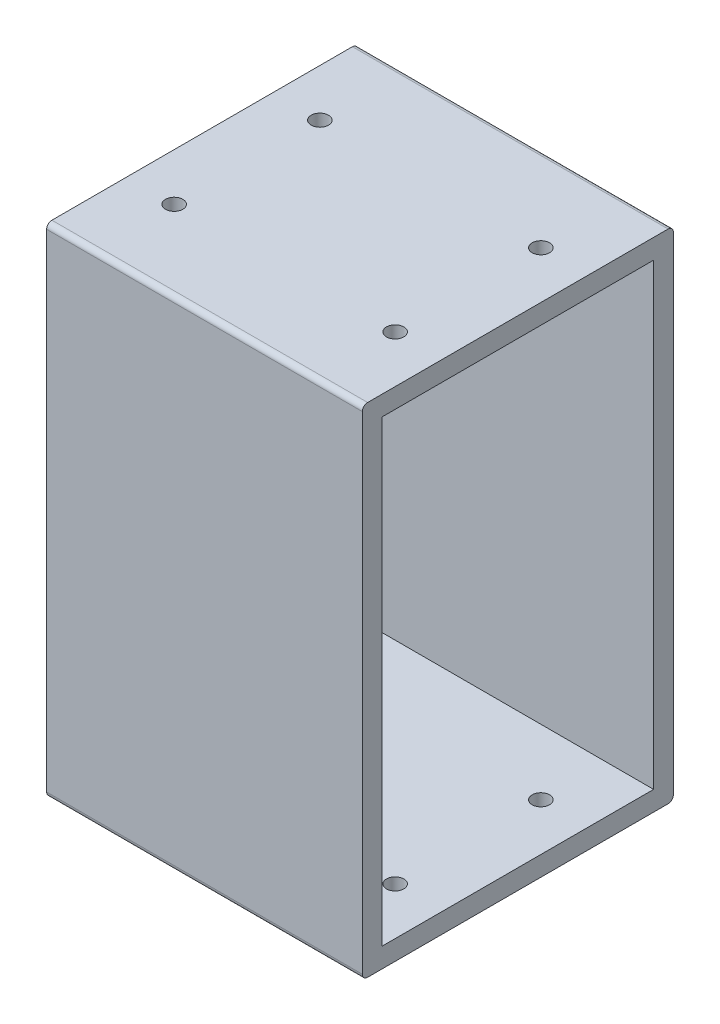
from build123d import *

# Parameters (mm, degrees)
SKETCH2_W               = 75.057
SKETCH2_H               = 120.142
BOSS_EXTRUDE1_DEPTH     = 76.2
CUT_EXTRUDE1_REACH      = 106.035
SKETCH6_W               = 65.532
SKETCH6_H               = 110.617
FILLET1_R               = 1.27
CUT_EXTRUDE3_DEPTH      = 148.135748465
CUT_EXTRUDE3_DEPTH_BACK = 148.135748465
SKETCH7_R               = 2.0955


with BuildPart() as part:
    # Sketch2 → Boss-Extrude1 (new body)
    with BuildSketch(Plane(origin=(0, 0, 0), x_dir=(0, 0, -1), z_dir=(1, 0, 0))):
        Rectangle(SKETCH2_W, SKETCH2_H)
    extrude(amount=BOSS_EXTRUDE1_DEPTH)

    # Sketch6 → Cut-Extrude1 (cut, up to next)
    with BuildSketch(Plane.ZY, mode=Mode.PRIVATE) as cut_extrude1_sk1:
        Rectangle(SKETCH6_W, SKETCH6_H)
    cut_extrude1_tool1 = extrude(cut_extrude1_sk1.sketch, amount=-CUT_EXTRUDE1_REACH, mode=Mode.PRIVATE) & part.part
    add(cut_extrude1_tool1.solids().sort_by_distance((0, 0, 0))[0], mode=Mode.SUBTRACT)

    # Fillet1
    fillet1_edges = [part.edges().sort_by_distance(p)[0] for p in [
        (38.1, -60.071, -37.5285),
        (38.1, -60.071, 37.5285),
        (38.1, 60.071, 37.5285),
        (38.1, 60.071, -37.5285),
    ]]
    fillet(fillet1_edges, radius=FILLET1_R)

    # Sketch7 → Cut-Extrude3 (cut, two sides: drawn at the far end of the back side and taken through both)
    with BuildSketch(Plane.XZ.offset(60.071).offset(-CUT_EXTRUDE3_DEPTH_BACK)):
        with Locations(Location((11.43, 18.1864, 0), (0, 0, 270))):
            Circle(SKETCH7_R)
        with Locations(Location((64.77, 18.1864, 0), (0, 0, 270))):
            Circle(SKETCH7_R)
        with Locations(Location((11.43, -16.9799, 0), (0, 0, 270))):
            Circle(SKETCH7_R)
        with Locations(Location((64.77, -16.9799, 0), (0, 0, 270))):
            Circle(SKETCH7_R)
    extrude(amount=CUT_EXTRUDE3_DEPTH + CUT_EXTRUDE3_DEPTH_BACK, mode=Mode.SUBTRACT)


solid = part.part
